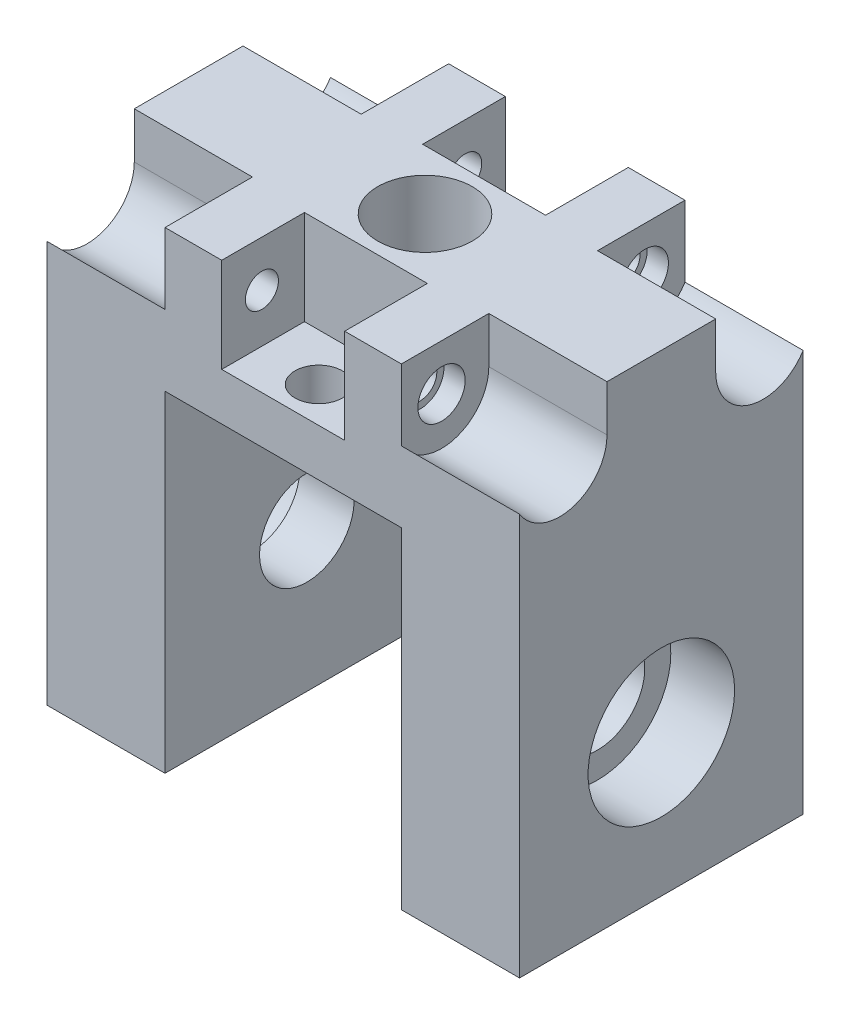
from build123d import *

# Parameters (mm, degrees)
SKETCH_1_W                = 10
SKETCH_1_H                = 12
EXTRUDE_1_DEPTH           = 6
SKETCH_2_R                = 1
CUT_EXTRUDE_1_DEPTH       = 17.733200531
SKETCH_2_3_R              = 2
CUT_EXTRUDE_2_DEPTH       = 4
SKETCH_3_R                = 2
CUT_EXTRUDE_3_DEPTH       = 17.733200531
SKETCH_4_W                = 5.2
SKETCH_4_H                = 3.5
CUT_EXTRUDE_4_DEPTH       = 4
SKETCH_6_R                = 0.7
CUT_EXTRUDE_5_DEPTH       = 17.733200531
SKETCH_6_3_R              = 1
CUT_EXTRUDE_6_DEPTH       = 0.9
CUT_EXTRUDE_START         = -9.1
SKETCH_6_4_R              = 1
CUT_EXTRUDE_7_DEPTH       = 0.9
SKETCH_7_W                = 12
SKETCH_7_H                = 20
EXTRUDE_2_DEPTH           = 5
CUT_EXTRUDE_START_2       = 5
CUT_EXTRUDE_8_DEPTH       = 5
EXTRUDE_START             = -10
SKETCH_7_4_W              = 12
SKETCH_7_4_H              = 20
EXTRUDE_3_DEPTH           = 5
CUT_EXTRUDE_START_3       = -10
SKETCH_7_5_R              = 1
CUT_EXTRUDE_9_DEPTH       = 5
CUT_EXTRUDE_10_DEPTH      = 24.769728648
CUT_EXTRUDE_10_DEPTH_BACK = 24.769728648
SKETCH_7_6_R              = 2
SKETCH_7_7_R              = 3.1
CUT_EXTRUDE_11_DEPTH      = 2.7
CUT_EXTRUDE_START_4       = -12.3
SKETCH_7_8_R              = 3.1
CUT_EXTRUDE_12_DEPTH      = 2.7


with BuildPart() as part:
    # 草图1 → 凸台-拉伸1 (new body)
    with BuildSketch(Plane(origin=(0, 0, 0), x_dir=(1, 0, 0), z_dir=(0, 1, 0))):
        with Locations((5, -6)):
            Rectangle(SKETCH_1_W, SKETCH_1_H)
    extrude(amount=EXTRUDE_1_DEPTH)

    # 草图2 → 切除-拉伸1 (cut, through all)
    with BuildSketch(Plane(origin=(0, 6, 0), x_dir=(1, 0, 0), z_dir=(0, 1, 0))):
        with Locations(Location((5, -1.5, 0), (0, 0, 270))):
            Circle(SKETCH_2_R)
        with Locations(Location((5, -10.5, 0), (0, 0, 270))):
            Circle(SKETCH_2_R)
    extrude(amount=-CUT_EXTRUDE_1_DEPTH, mode=Mode.SUBTRACT)

    # 草图2<3> → 切除-拉伸2 (cut)
    with BuildSketch(Plane(origin=(0, 6, 0), x_dir=(1, 0, 0), z_dir=(0, 1, 0))):
        with Locations((5, -1.5)):
            Circle(SKETCH_2_3_R)
        with Locations((5, -10.5)):
            Circle(SKETCH_2_3_R)
    extrude(amount=-CUT_EXTRUDE_2_DEPTH, mode=Mode.SUBTRACT)

    # 草图3 → 切除-拉伸3 (cut, through all)
    with BuildSketch(Plane(origin=(0, 6, 0), x_dir=(1, 0, 0), z_dir=(0, 1, 0))):
        with Locations(Location((5, -6, 0), (0, 0, 270))):
            Circle(SKETCH_3_R)
    extrude(amount=-CUT_EXTRUDE_3_DEPTH, mode=Mode.SUBTRACT)

    # 草图4 → 切除-拉伸4 (cut)
    with BuildSketch(Plane(origin=(0, 6, 0), x_dir=(1, 0, 0), z_dir=(0, 1, 0))):
        with Locations((5, -1.75)):
            Rectangle(SKETCH_4_W, SKETCH_4_H)
        with Locations((5, -10.25)):
            Rectangle(SKETCH_4_W, SKETCH_4_H)
    extrude(amount=-CUT_EXTRUDE_4_DEPTH, mode=Mode.SUBTRACT)

    # 草图6 → 切除-拉伸5 (cut, through all)
    with BuildSketch(Plane.ZY):
        with Locations((1.7, 4.05)):
            Circle(SKETCH_6_R)
        with Locations((10.3, 4.05)):
            Circle(SKETCH_6_R)
    extrude(amount=-CUT_EXTRUDE_5_DEPTH, mode=Mode.SUBTRACT)

    # 草图6<3> → 切除-拉伸6 (cut)
    with BuildSketch(Plane.ZY):
        with Locations((1.7, 4.05)):
            Circle(SKETCH_6_3_R)
        with Locations((10.3, 4.05)):
            Circle(SKETCH_6_3_R)
    extrude(amount=-CUT_EXTRUDE_6_DEPTH, mode=Mode.SUBTRACT)

    # 草图6<4> → 切除-拉伸7 (cut)
    with BuildSketch(Plane.ZY.offset(CUT_EXTRUDE_START)):
        with Locations((1.7, 4.05)):
            Circle(SKETCH_6_4_R)
        with Locations((10.3, 4.05)):
            Circle(SKETCH_6_4_R)
    extrude(amount=-CUT_EXTRUDE_7_DEPTH, mode=Mode.SUBTRACT)

    # 草图7 → 凸台-拉伸2 (add)
    with BuildSketch(Plane(origin=(10, 0, 0), x_dir=(0, 0, -1), z_dir=(1, 0, 0))):
        with Locations((-6, -4)):
            Rectangle(SKETCH_7_W, SKETCH_7_H)
    extrude(amount=EXTRUDE_2_DEPTH)

    # 草图7<3> → 切除-拉伸8 (cut)
    with BuildSketch(Plane(origin=(10, 0, 0), x_dir=(0, 0, -1), z_dir=(1, 0, 0)).offset(CUT_EXTRUDE_START_2)):
        with BuildLine():
            ThreePointArc((-8.3, 4.05), (-8.736539185, 5.297233049), (-9.855590279, 6))
            Line((-9.855590279, 6), (-10.744409721, 6))
            ThreePointArc((-10.744409721, 6), (-11.462119625, 5.677721714), (-12, 5.103565375))
            Line((-12, 5.103565375), (-12, 2.996434625))
            ThreePointArc((-12, 2.996434625), (-9.752277442, 2.126461594), (-8.3, 4.05))
        make_face()
        with BuildLine():
            ThreePointArc((-12, 5.103565375), (-11.462119625, 5.677721714), (-10.744409721, 6))
            Line((-10.744409721, 6), (-12, 6))
            Line((-12, 6), (-12, 5.103565375))
        make_face()
        with BuildLine():
            Line((-1.255590279, 6), (-2.144409721, 6))
            ThreePointArc((-2.144409721, 6), (-3.263460815, 5.297233049), (-3.7, 4.05))
            ThreePointArc((-3.7, 4.05), (-2.247722558, 2.126461594), (0, 2.996434625))
            Line((0, 2.996434625), (0, 5.103565375))
            ThreePointArc((0, 5.103565375), (-0.537880375, 5.677721714), (-1.255590279, 6))
        make_face()
        with BuildLine():
            Line((0, 6), (-1.255590279, 6))
            ThreePointArc((-1.255590279, 6), (-0.537880375, 5.677721714), (0, 5.103565375))
            Line((0, 5.103565375), (0, 6))
        make_face()
        with BuildLine():
            Line((-8.3, 4.05), (-8.3, 6))
            Line((-8.3, 6), (-9.855590279, 6))
            ThreePointArc((-9.855590279, 6), (-8.736539185, 5.297233049), (-8.3, 4.05))
        make_face()
        with BuildLine():
            Line((-2.144409721, 6), (-3.7, 6))
            Line((-3.7, 6), (-3.7, 4.05))
            ThreePointArc((-3.7, 4.05), (-3.263460815, 5.297233049), (-2.144409721, 6))
        make_face()
    extrude(amount=-CUT_EXTRUDE_8_DEPTH, mode=Mode.SUBTRACT)

    # 草图7<4> → 凸台-拉伸3 (add)
    with BuildSketch(Plane(origin=(10, 0, 0), x_dir=(0, 0, -1), z_dir=(1, 0, 0)).offset(EXTRUDE_START)):
        with Locations((-6, -4)):
            Rectangle(SKETCH_7_4_W, SKETCH_7_4_H)
    extrude(amount=-EXTRUDE_3_DEPTH)

    # 草图7<5> → 切除-拉伸9 (cut)
    # profile 1 of 8: a face of its own
    with BuildSketch(Plane(origin=(10, 0, 0), x_dir=(0, 0, -1), z_dir=(1, 0, 0)).offset(CUT_EXTRUDE_START_3)):
        with BuildLine():
            ThreePointArc((-8.3, 4.05), (-8.736539185, 5.297233049), (-9.855590279, 6))
            Line((-9.855590279, 6), (-10.744409721, 6))
            ThreePointArc((-10.744409721, 6), (-11.462119625, 5.677721714), (-12, 5.103565375))
            Line((-12, 5.103565375), (-12, 2.996434625))
            ThreePointArc((-12, 2.996434625), (-9.752277442, 2.126461594), (-8.3, 4.05))
        make_face()
        with Locations(Location((-10.3, 4.05, 0), (0, 0, 180))):
            Circle(SKETCH_7_5_R, mode=Mode.SUBTRACT)
    # profile 2 of 8: a face of its own
    with BuildSketch(Plane(origin=(10, 0, 0), x_dir=(0, 0, -1), z_dir=(1, 0, 0)).offset(CUT_EXTRUDE_START_3)):
        with BuildLine():
            Line((-8.3, 4.05), (-8.3, 6))
            Line((-8.3, 6), (-9.855590279, 6))
            ThreePointArc((-9.855590279, 6), (-8.736539185, 5.297233049), (-8.3, 4.05))
        make_face()
    # profile 3 of 8: a face of its own
    with BuildSketch(Plane(origin=(10, 0, 0), x_dir=(0, 0, -1), z_dir=(1, 0, 0)).offset(CUT_EXTRUDE_START_3)):
        with BuildLine():
            ThreePointArc((-12, 5.103565375), (-11.462119625, 5.677721714), (-10.744409721, 6))
            Line((-10.744409721, 6), (-12, 6))
            Line((-12, 6), (-12, 5.103565375))
        make_face()
    # profile 4 of 8: a face of its own
    with BuildSketch(Plane(origin=(10, 0, 0), x_dir=(0, 0, -1), z_dir=(1, 0, 0)).offset(CUT_EXTRUDE_START_3)):
        with BuildLine():
            Line((-1.255590279, 6), (-2.144409721, 6))
            ThreePointArc((-2.144409721, 6), (-3.263460815, 5.297233049), (-3.7, 4.05))
            ThreePointArc((-3.7, 4.05), (-2.247722558, 2.126461594), (0, 2.996434625))
            Line((0, 2.996434625), (0, 5.103565375))
            ThreePointArc((0, 5.103565375), (-0.537880375, 5.677721714), (-1.255590279, 6))
        make_face()
        with Locations(Location((-1.7, 4.05, 0), (0, 0, 180))):
            Circle(SKETCH_7_5_R, mode=Mode.SUBTRACT)
    # profile 5 of 8: a face of its own
    with BuildSketch(Plane(origin=(10, 0, 0), x_dir=(0, 0, -1), z_dir=(1, 0, 0)).offset(CUT_EXTRUDE_START_3)):
        with BuildLine():
            Line((-2.144409721, 6), (-3.7, 6))
            Line((-3.7, 6), (-3.7, 4.05))
            ThreePointArc((-3.7, 4.05), (-3.263460815, 5.297233049), (-2.144409721, 6))
        make_face()
    # profile 6 of 8: a face of its own
    with BuildSketch(Plane(origin=(10, 0, 0), x_dir=(0, 0, -1), z_dir=(1, 0, 0)).offset(CUT_EXTRUDE_START_3)):
        with BuildLine():
            Line((0, 6), (-1.255590279, 6))
            ThreePointArc((-1.255590279, 6), (-0.537880375, 5.677721714), (0, 5.103565375))
            Line((0, 5.103565375), (0, 6))
        make_face()
    # profile 7 of 8: a face of its own
    with BuildSketch(Plane(origin=(10, 0, 0), x_dir=(0, 0, -1), z_dir=(1, 0, 0)).offset(CUT_EXTRUDE_START_3)):
        with Locations(Location((-10.3, 4.05, 0), (0, 0, 180))):
            Circle(SKETCH_7_5_R)
    # profile 8 of 8: a face of its own
    with BuildSketch(Plane(origin=(10, 0, 0), x_dir=(0, 0, -1), z_dir=(1, 0, 0)).offset(CUT_EXTRUDE_START_3)):
        with Locations(Location((-1.7, 4.05, 0), (0, 0, 180))):
            Circle(SKETCH_7_5_R)
    extrude(amount=-CUT_EXTRUDE_9_DEPTH, mode=Mode.SUBTRACT)

    # 草图7<6> → 切除-拉伸10 (cut, two sides: drawn at the far end of the back side and taken through both)
    with BuildSketch(Plane(origin=(10, 0, 0), x_dir=(0, 0, -1), z_dir=(1, 0, 0)).offset(-CUT_EXTRUDE_10_DEPTH_BACK)):
        with Locations((-6, -8)):
            Circle(SKETCH_7_6_R)
    extrude(amount=CUT_EXTRUDE_10_DEPTH + CUT_EXTRUDE_10_DEPTH_BACK, mode=Mode.SUBTRACT)

    # 草图7<7> → 切除-拉伸11 (cut)
    with BuildSketch(Plane(origin=(10, 0, 0), x_dir=(0, 0, -1), z_dir=(1, 0, 0)).offset(CUT_EXTRUDE_START_2)):
        with Locations((-6, -8)):
            Circle(SKETCH_7_7_R)
    extrude(amount=-CUT_EXTRUDE_11_DEPTH, mode=Mode.SUBTRACT)

    # 草图7<8> → 切除-拉伸12 (cut)
    with BuildSketch(Plane(origin=(10, 0, 0), x_dir=(0, 0, -1), z_dir=(1, 0, 0)).offset(CUT_EXTRUDE_START_4)):
        with Locations((-6, -8)):
            Circle(SKETCH_7_8_R)
    extrude(amount=-CUT_EXTRUDE_12_DEPTH, mode=Mode.SUBTRACT)


solid = part.part
